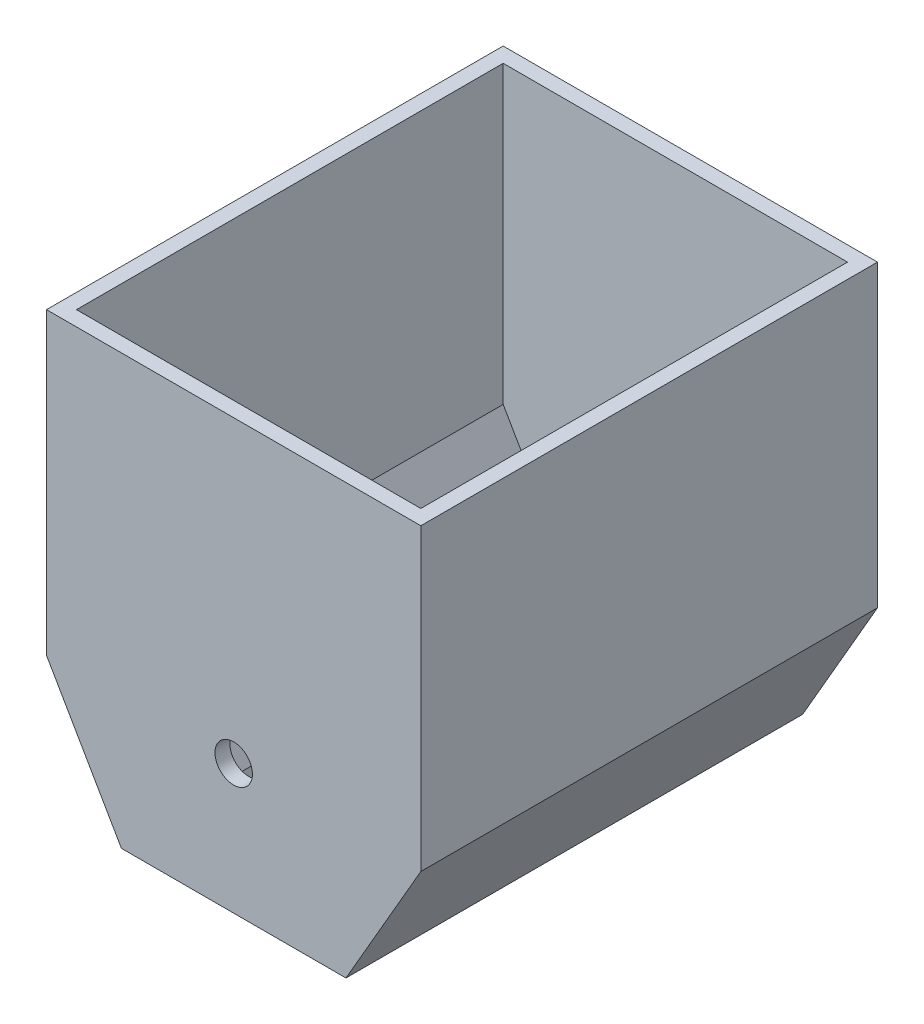
from build123d import *

# Parameters (mm, degrees)
BOSS_EXTRUDE1_DEPTH     = 38.735
SHELL1_T                = -2.54
SKETCH4_W               = 35.167060632
SKETCH4_H               = 72.39
CUT_EXTRUDE1_DEPTH      = 87.281603677
CUT_EXTRUDE2_DEPTH      = 111.946262659
CUT_EXTRUDE2_DEPTH_BACK = 111.946262659
SKETCH6_R               = 3.175


with BuildPart() as part:
    # Sketch1 → Boss-Extrude1 (new, symmetric)
    with BuildSketch(Plane.XY):
        Polygon((-19.05, 0), (19.05, 0), (31.75, 21.997045256), (31.75, 72.797045256), (-31.75, 72.797045256), (-31.75, 21.997045256), align=None)
    extrude(amount=BOSS_EXTRUDE1_DEPTH, both=True)

    # Shell1
    shell1_openings = [part.faces().sort_by_distance(p)[0] for p in [
        (0, 72.797045256, 0),
    ]]
    offset(amount=SHELL1_T, openings=shell1_openings, kind=Kind.INTERSECTION)

    # Sketch4 → Cut-Extrude1 (cut, through all)
    with BuildSketch(Plane(origin=(0, 2.54, 0), x_dir=(1, 0, 0), z_dir=(0, 1, 0))):
        Rectangle(SKETCH4_W, SKETCH4_H)
    extrude(amount=-CUT_EXTRUDE1_DEPTH, mode=Mode.SUBTRACT)

    # Sketch6 → Cut-Extrude2 (cut, two sides: drawn at the far end of the back side and taken through both)
    with BuildSketch(Plane.XY.offset(38.735).offset(-CUT_EXTRUDE2_DEPTH_BACK)):
        with Locations((0, 21.997045256)):
            Circle(SKETCH6_R)
    extrude(amount=CUT_EXTRUDE2_DEPTH + CUT_EXTRUDE2_DEPTH_BACK, mode=Mode.SUBTRACT)


solid = part.part
